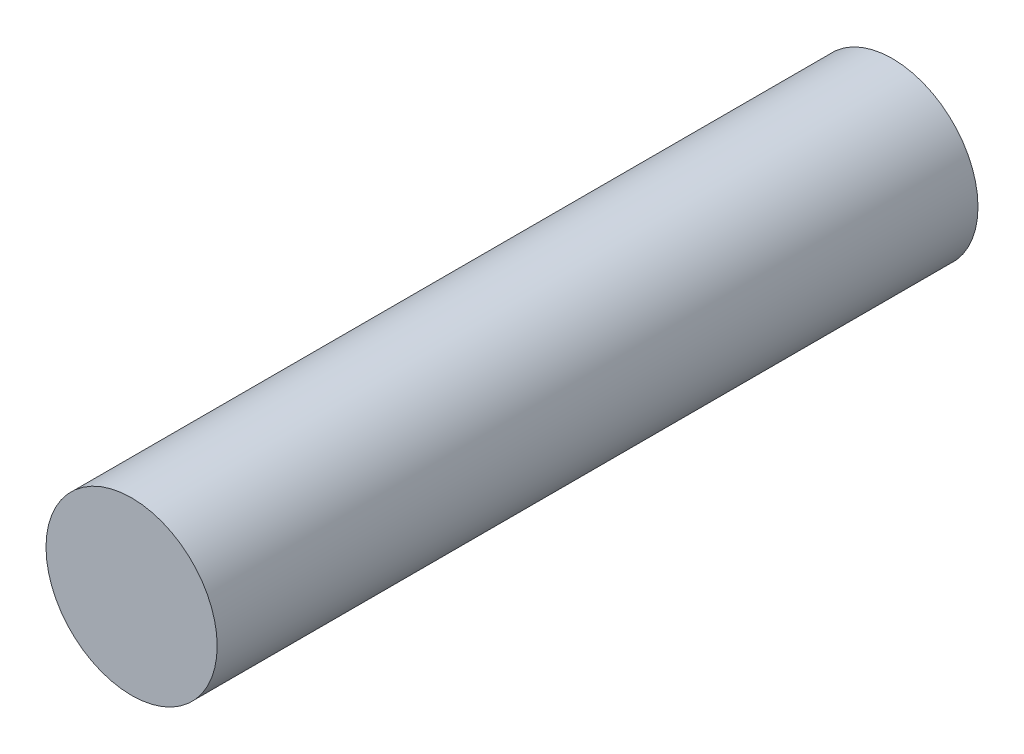
from build123d import *

# Parameters (mm, degrees)
SKETCH1_R           = 9
BOSS_EXTRUDE1_DEPTH = 40


with BuildPart() as part:
    # Sketch1 → Boss-Extrude1 (new, symmetric)
    with BuildSketch(Plane.XY):
        Circle(SKETCH1_R)
    extrude(amount=BOSS_EXTRUDE1_DEPTH, both=True)


solid = part.part
